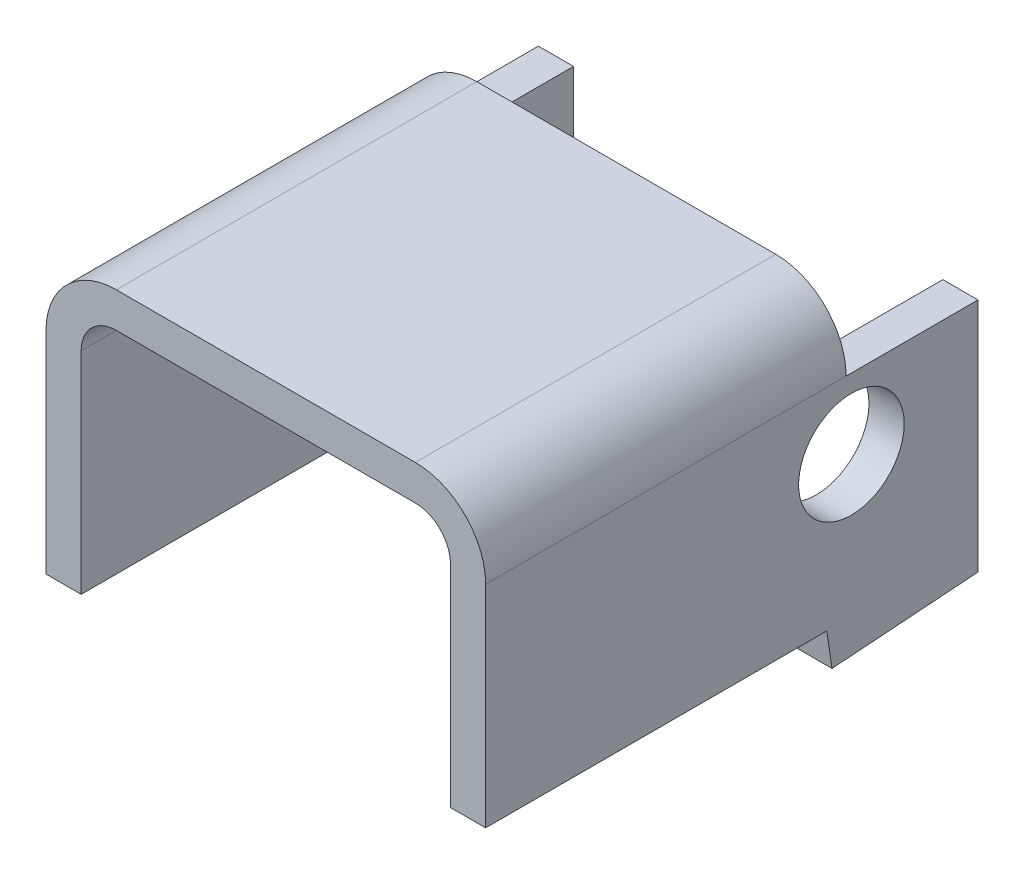
from build123d import *

# Parameters (mm, degrees)
SKETCH1_R           = 1.5
BOSS_EXTRUDE1_DEPTH = 0.5
SKETCH2_R           = 1.5
BOSS_EXTRUDE2_DEPTH = 0.5
BOSS_EXTRUDE6_DEPTH = 10.25


with BuildPart() as part:
    # Sketch1 → Boss-Extrude1 (new, symmetric)
    with BuildSketch(Plane(origin=(0, 0, 0), x_dir=(0, 0, -1), z_dir=(1, 0, 0))):
        Polygon((0, 0), (0, 6), (14, 6), (14, -0.7), (9.85, -1), (9.7, 0), align=None)
        with Locations((10.4, 4)):
            Circle(SKETCH1_R, mode=Mode.SUBTRACT)
    extrude(amount=BOSS_EXTRUDE1_DEPTH, both=True)



with BuildPart() as body_2:
    # Sketch2 → Boss-Extrude2 (new, symmetric)
    with BuildSketch(Plane.ZY.offset(11.5)):
        Polygon((-9.7, 0), (-9.85, -1), (-14, -0.7), (-14, 6), (0, 6), (0, 0), align=None)
        with Locations(Location((-10.4, 4, 0), (0, 0, 180))):
            Circle(SKETCH2_R, mode=Mode.SUBTRACT)
    extrude(amount=BOSS_EXTRUDE2_DEPTH, both=True)


with BuildPart() as part_1:
    add(part.part)

    add(body_2.part)  # Boss-Extrude6 merges body 2
    # Sketch9 → Boss-Extrude6 (add)
    with BuildSketch(Plane.XY):
        with BuildLine():
            Line((-11, 6), (-12, 6))
            ThreePointArc((-12, 6), (-11.414213562, 7.414213562), (-10, 8))
            Line((-10, 8), (-1.5, 8))
            ThreePointArc((-1.5, 8), (-0.085786438, 7.414213562), (0.5, 6))
            Line((0.5, 6), (-0.5, 6))
            ThreePointArc((-0.5, 6), (-0.792893219, 6.707106781), (-1.5, 7))
            Line((-1.5, 7), (-10, 7))
            ThreePointArc((-10, 7), (-10.707106781, 6.707106781), (-11, 6))
        make_face()
    extrude(amount=-BOSS_EXTRUDE6_DEPTH)


solid = part_1.part
